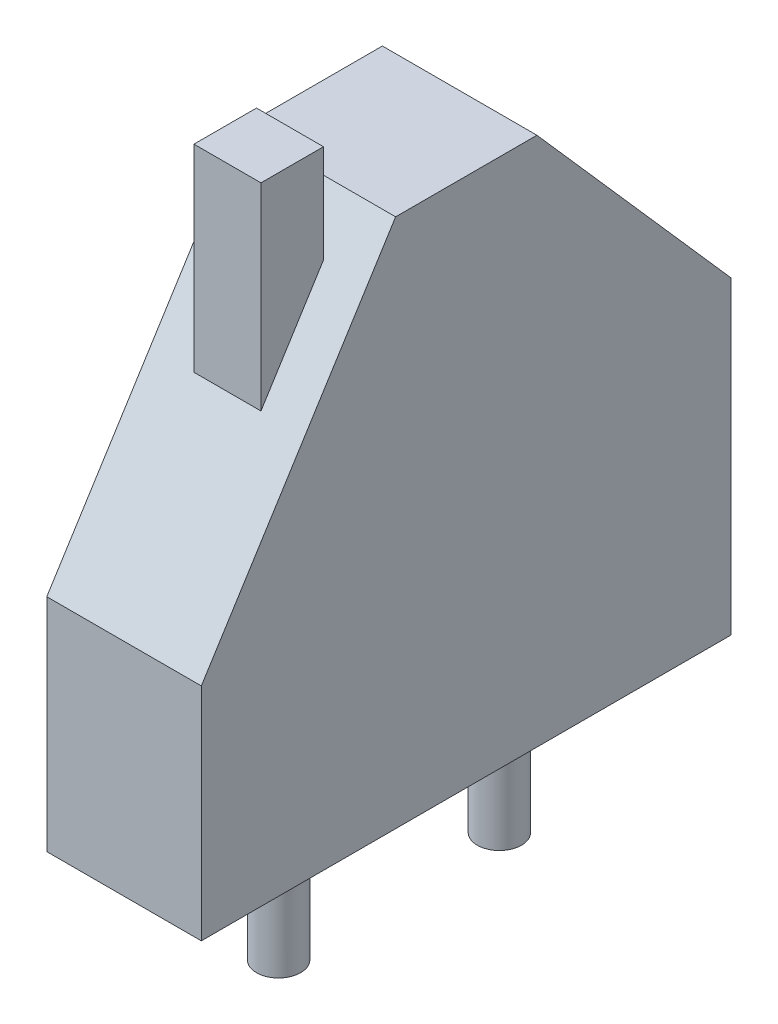
from build123d import *

# Parameters (mm, degrees)
SKETCH_1_W          = 3.5
SKETCH_1_H          = 12
EXTRUDE_1_DEPTH     = 12
SKETCH_2_R          = 0.5
EXTRUDE_2_DEPTH     = 3
CUT_EXTRUDE_1_DEPTH = 5
SKETCH_4_W          = 1.517225246
SKETCH_4_H          = 1.416076897
EXTRUDE_1_2_DEPTH   = 13.2


with BuildPart() as part:
    # 草图1 → Extrude 1 (new body)
    with BuildSketch(Plane(origin=(0, 0, 0), x_dir=(1, 0, 0), z_dir=(0, 1, 0))):
        Rectangle(SKETCH_1_W, SKETCH_1_H)
    extrude(amount=EXTRUDE_1_DEPTH)

    # 草图2 → 拉伸2 (add)
    with BuildSketch(Plane.XZ):
        with Locations(Location((0, 2.5, 0), (0, 0, 90))):
            Circle(SKETCH_2_R)
        with Locations(Location((0, -2.5, 0), (0, 0, 90))):
            Circle(SKETCH_2_R)
    extrude(amount=EXTRUDE_2_DEPTH)

    # 草图3 → 切除-拉伸1 (cut)
    with BuildSketch(Plane(origin=(1.75, 0, 0), x_dir=(0, 0, -1), z_dir=(1, 0, 0))):
        Polygon((-1.6, 12), (-6, 5), (-6, 12), align=None)
        Polygon((1.6, 12), (6, 7), (6, 12), align=None)
    extrude(amount=-CUT_EXTRUDE_1_DEPTH, mode=Mode.SUBTRACT)

    # 草图4 → Extrude 1 2 (add)
    with BuildSketch(Plane.XZ):
        with Locations((0, 2.950160203)):
            Rectangle(SKETCH_4_W, SKETCH_4_H)
    extrude(amount=-EXTRUDE_1_2_DEPTH)


solid = part.part
